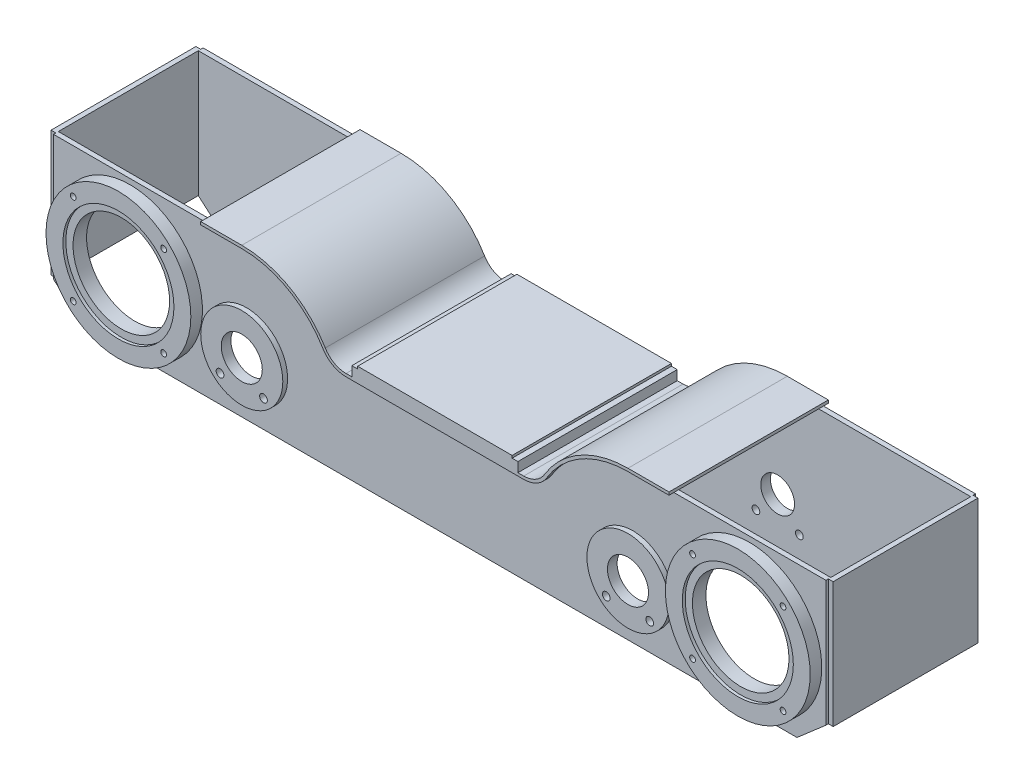
from build123d import *

# Parameters (mm, degrees)
SKETCH_1_R             = 35
SKETCH_1_R_2           = 8
EXTRUDE_1_DEPTH        = 310
SKETCH_2_W             = 1600
SKETCH_2_H             = 290
CUT_EXTRUDE_1_DEPTH    = 913.931541793
SKETCH_3_R             = 100
SKETCH_3_R_2           = 6
SKETCH_3_R_3           = 42.5
CUT_EXTRUDE_2_DEPTH    = 10
EXTRUDE_2_DEPTH        = 330
SKETCH_6_W             = 300
SKETCH_6_H             = 260
EXTRUDE_3_DEPTH        = 10
SKETCH_7_W             = 300
SKETCH_7_H             = 260
EXTRUDE_4_DEPTH        = 10
SKETCH_9_W             = 10
SKETCH_9_H             = 290
EXTRUDE_5_DEPTH        = 184
SKETCH_10_W            = 420
SKETCH_10_H            = 290
EXTRUDE_6_DEPTH        = 6
SKETCH_11_R            = 85
SKETCH_11_R_2          = 42.5
SKETCH_11_R_3          = 8
EXTRUDE_7_DEPTH        = 10
SKETCH_12_R            = 85
SKETCH_12_R_2          = 35
SKETCH_12_R_3          = 8
EXTRUDE_8_DEPTH        = 10
PATTERN_LINEAR_2_COUNT = 2
PATTERN_LINEAR_2_PITCH = 800
SKETCH_13_R            = 150
SKETCH_13_R_2          = 100
SKETCH_13_R_3          = 6
EXTRUDE_9_DEPTH        = 24
SKETCH_14_R            = 115
CUT_EXTRUDE_3_DEPTH    = 6
SKETCH_17_W            = 344
SKETCH_17_H            = 330
EXTRUDE_11_DEPTH       = 20
SKETCH_16_W            = 320
SKETCH_16_H            = 330
EXTRUDE_10_DEPTH       = 5


with BuildPart() as part:
    # 草图1 → 凸台-拉伸1 (new body)
    with BuildSketch(Plane.XY):
        with BuildLine():
            Line((-740, 0), (740, 0))
            Line((740, 0), (800, 52))
            Line((800, 52), (800, 312))
            Line((800, 312), (400, 312))
            ThreePointArc((400, 312), (303.608851243, 286.659738783), (232.141956451, 217.191290218))
            ThreePointArc((232.141956451, 217.191290218), (211.645136257, 197.267627611), (184, 190))
            Line((184, 190), (-184, 190))
            ThreePointArc((-184, 190), (-211.645136257, 197.267627611), (-232.141956451, 217.191290218))
            ThreePointArc((-232.141956451, 217.191290218), (-303.608851243, 286.659738783), (-400, 312))
            Line((-400, 312), (-800, 312))
            Line((-800, 312), (-800, 52))
            Line((-800, 52), (-740, 0))
        make_face()
        with Locations((-400, 116)):
            Circle(SKETCH_1_R, mode=Mode.SUBTRACT)
        with Locations((400, 116)):
            Circle(SKETCH_1_R, mode=Mode.SUBTRACT)
        with Locations((-445, 66)):
            Circle(SKETCH_1_R_2, mode=Mode.SUBTRACT)
        with Locations((-355, 66)):
            Circle(SKETCH_1_R_2, mode=Mode.SUBTRACT)
        with Locations((355, 66)):
            Circle(SKETCH_1_R_2, mode=Mode.SUBTRACT)
        with Locations((445, 66)):
            Circle(SKETCH_1_R_2, mode=Mode.SUBTRACT)
    extrude(amount=EXTRUDE_1_DEPTH)

    # 草图2 → 切除-拉伸1 (cut, through all)
    with BuildSketch(Plane(origin=(0, 0, 0), x_dir=(-1, 0, 0), z_dir=(0, -1, 0))):
        with Locations((0, -155)):
            Rectangle(SKETCH_2_W, SKETCH_2_H)
    extrude(amount=-CUT_EXTRUDE_1_DEPTH, mode=Mode.SUBTRACT)


with BuildPart() as cut_extrude_1_piece_1:
    # of the separate pieces the step leaves, piece 1, a body of its own (cut_extrude_1_pieces)
    add(part.part.solids().sort_by_distance((-740, 0, 0))[0])

    # 草图5 → 凸台-拉伸2 (add)
    with BuildSketch(Plane.XY.offset(-10)):
        with BuildLine():
            Line((485, 312), (485, 318))
            Line((485, 318), (400, 318))
            ThreePointArc((400, 318), (300.658101791, 291.8840165), (227.003444914, 220.288982775))
            ThreePointArc((227.003444914, 220.288982775), (208.694386805, 202.491905329), (184, 196))
            Line((184, 196), (-184, 196))
            ThreePointArc((-184, 196), (-208.694386805, 202.491905329), (-227.003444914, 220.288982775))
            ThreePointArc((-227.003444914, 220.288982775), (-300.658101791, 291.8840165), (-400, 318))
            Line((-400, 318), (-485, 318))
            Line((-485, 318), (-485, 312))
            Line((-485, 312), (-400, 312))
            ThreePointArc((-400, 312), (-303.608851243, 286.659738783), (-232.141956451, 217.191290218))
            ThreePointArc((-232.141956451, 217.191290218), (-211.645136257, 197.267627611), (-184, 190))
            Line((-184, 190), (184, 190))
            ThreePointArc((184, 190), (211.645136257, 197.267627611), (232.141956451, 217.191290218))
            ThreePointArc((232.141956451, 217.191290218), (303.608851243, 286.659738783), (400, 312))
            Line((400, 312), (485, 312))
        make_face()
    extrude(amount=EXTRUDE_2_DEPTH)



with BuildPart() as cut_extrude_1_piece_2:
    # of the separate pieces the step leaves, piece 2, a body of its own (cut_extrude_1_pieces)
    add(part.part.solids().sort_by_distance((-740, 0, 300))[0])

    # 草图3 → 切除-拉伸2 (cut)
    with BuildSketch(Plane.XY.offset(310)):
        with Locations((-641.476706951, 151)):
            Circle(SKETCH_3_R)
        with Locations((641.476706951, 151)):
            Circle(SKETCH_3_R)
        with Locations((-735.168355458, 244.691648507)):
            Circle(SKETCH_3_R_2)
        with Locations((-547.785058444, 244.691648507)):
            Circle(SKETCH_3_R_2)
        with Locations((-735.168355458, 57.308351493)):
            Circle(SKETCH_3_R_2)
        with Locations((-547.785058444, 57.308351493)):
            Circle(SKETCH_3_R_2)
        with Locations((547.785058444, 244.691648507)):
            Circle(SKETCH_3_R_2)
        with Locations((735.168355458, 244.691648507)):
            Circle(SKETCH_3_R_2)
        with Locations((735.168355458, 57.308351493)):
            Circle(SKETCH_3_R_2)
        with Locations((547.785058444, 57.308351493)):
            Circle(SKETCH_3_R_2)
        with Locations((-400, 116)):
            Circle(SKETCH_3_R_3)
        with Locations((400, 116)):
            Circle(SKETCH_3_R_3)
    extrude(amount=-CUT_EXTRUDE_2_DEPTH, mode=Mode.SUBTRACT)


with BuildPart() as cut_extrude_1_piece_1_1:
    add(cut_extrude_1_piece_1.part)

    add(cut_extrude_1_piece_2.part)  # 凸台-拉伸3 merges 切除-拉伸1 piece 2
    # 草图6 → 凸台-拉伸3 (add)
    with BuildSketch(Plane(origin=(800, 0, 0), x_dir=(0, 0, -1), z_dir=(1, 0, 0))):
        with Locations((-155, 182)):
            Rectangle(SKETCH_6_W, SKETCH_6_H)
    extrude(amount=EXTRUDE_3_DEPTH)

    # 草图7 → 凸台-拉伸4 (add)
    with BuildSketch(Plane.ZY.offset(800)):
        with Locations((155, 182)):
            Rectangle(SKETCH_7_W, SKETCH_7_H)
    extrude(amount=EXTRUDE_4_DEPTH)

    # 草图9 → 凸台-拉伸5 (add)
    with BuildSketch(Plane.XZ.offset(-190)):
        with Locations((-105, 155)):
            Rectangle(SKETCH_9_W, SKETCH_9_H)
        with Locations((105, 155)):
            Rectangle(SKETCH_9_W, SKETCH_9_H)
        with Locations((155, 155)):
            Rectangle(SKETCH_9_W, SKETCH_9_H)
        with Locations((-155, 155)):
            Rectangle(SKETCH_9_W, SKETCH_9_H)
    extrude(amount=EXTRUDE_5_DEPTH)

    # 草图10 → 凸台-拉伸6 (add)
    with BuildSketch(Plane.XZ.offset(-6)):
        with Locations((0, 155)):
            Rectangle(SKETCH_10_W, SKETCH_10_H)
    extrude(amount=EXTRUDE_6_DEPTH)

    # 草图11 → 凸台-拉伸7 (add)
    with BuildSketch(Plane.XY.offset(310)):
        with Locations(Location((-400, 116, 0), (0, 0, 180))):
            Circle(SKETCH_11_R)
        with Locations((-400, 116)):
            Circle(SKETCH_11_R_2, mode=Mode.SUBTRACT)
        with Locations((-445, 66)):
            Circle(SKETCH_11_R_3, mode=Mode.SUBTRACT)
        with Locations((-355, 66)):
            Circle(SKETCH_11_R_3, mode=Mode.SUBTRACT)
    extrude_7 = extrude(amount=EXTRUDE_7_DEPTH)

    # 草图12 → 凸台-拉伸8 (add)
    with BuildSketch(Plane(origin=(0, 0, 0), x_dir=(-1, 0, 0), z_dir=(0, 0, -1))):
        with Locations((400, 116)):
            Circle(SKETCH_12_R)
        with Locations((400, 116)):
            Circle(SKETCH_12_R_2, mode=Mode.SUBTRACT)
        with Locations(Location((355, 66, 0), (0, 0, 180))):
            Circle(SKETCH_12_R_3, mode=Mode.SUBTRACT)
        with Locations(Location((445, 66, 0), (0, 0, 180))):
            Circle(SKETCH_12_R_3, mode=Mode.SUBTRACT)
    extrude_8 = extrude(amount=EXTRUDE_8_DEPTH)

    # 阵列(线性)2: 凸台-拉伸7, 凸台-拉伸8 ×2
    with Locations(*[(i * PATTERN_LINEAR_2_PITCH, 0, 0) for i in range(1, PATTERN_LINEAR_2_COUNT)]):
        add(extrude_7)
        add(extrude_8)

    # 草图13 → 凸台-拉伸9 (add)
    # profile 1 of 2: a face of its own
    with BuildSketch(Plane.XY.offset(310)):
        with Locations(Location((-641.476706951, 151, 0), (0, 0, 180))):
            Circle(SKETCH_13_R)
        with Locations((-641.476706951, 151)):
            Circle(SKETCH_13_R_2, mode=Mode.SUBTRACT)
        with Locations((-735.168355458, 244.691648507)):
            Circle(SKETCH_13_R_3, mode=Mode.SUBTRACT)
        with Locations((-547.785058444, 244.691648507)):
            Circle(SKETCH_13_R_3, mode=Mode.SUBTRACT)
        with Locations((-547.785058444, 57.308351493)):
            Circle(SKETCH_13_R_3, mode=Mode.SUBTRACT)
        with Locations((-735.168355458, 57.308351493)):
            Circle(SKETCH_13_R_3, mode=Mode.SUBTRACT)
    # profile 2 of 2: a face of its own
    with BuildSketch(Plane.XY.offset(310)):
        with Locations(Location((641.476706951, 151, 0), (0, 0, 180))):
            Circle(SKETCH_13_R)
        with Locations((735.168355458, 244.691648507)):
            Circle(SKETCH_13_R_3, mode=Mode.SUBTRACT)
        with Locations((547.785058444, 57.308351493)):
            Circle(SKETCH_13_R_3, mode=Mode.SUBTRACT)
        with Locations((735.168355458, 57.308351493)):
            Circle(SKETCH_13_R_3, mode=Mode.SUBTRACT)
        with Locations((547.785058444, 244.691648507)):
            Circle(SKETCH_13_R_3, mode=Mode.SUBTRACT)
        with Locations((641.476706951, 151)):
            Circle(SKETCH_13_R_2, mode=Mode.SUBTRACT)
    extrude(amount=EXTRUDE_9_DEPTH)

    # 草图14 → 切除-拉伸3 (cut)
    with BuildSketch(Plane.XY.offset(334)):
        with Locations((-641.476706951, 151)):
            Circle(SKETCH_14_R)
        with Locations((641.476706951, 151)):
            Circle(SKETCH_14_R)
    extrude(amount=-CUT_EXTRUDE_3_DEPTH, mode=Mode.SUBTRACT)

    # 草图17 → 凸台-拉伸11 (add)
    with BuildSketch(Plane(origin=(0, 196, 0), x_dir=(1, 0, 0), z_dir=(0, 1, 0))):
        with Locations((0, -155)):
            Rectangle(SKETCH_17_W, SKETCH_17_H)
    extrude(amount=EXTRUDE_11_DEPTH)

    # 草图16 → 凸台-拉伸10 (add)
    with BuildSketch(Plane(origin=(0, 216, 0), x_dir=(1, 0, 0), z_dir=(0, 1, 0))):
        with Locations((0, -155)):
            Rectangle(SKETCH_16_W, SKETCH_16_H)
    extrude(amount=EXTRUDE_10_DEPTH)


solid = cut_extrude_1_piece_1_1.part
